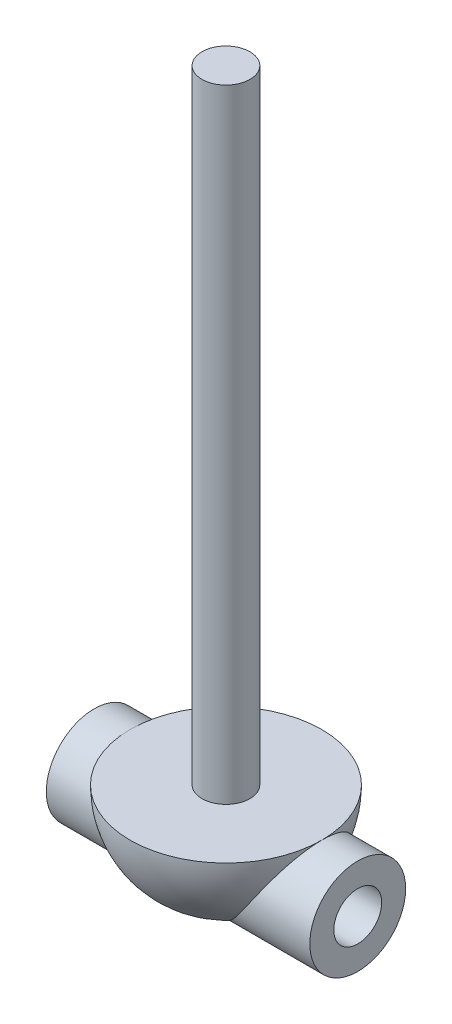
from build123d import *

# Parameters (mm, degrees)
OBR_T1_ANGLE                     = 180
DODANIE_WYCI_GNI_CIE1_DEPTH      = 27.5
DODANIE_WYCI_GNI_CIE1_DEPTH_BACK = 27.5
SZKIC4_R                         = 10
SZKIC5_R                         = 5
WYTNIJ_WYCI_GNI_CIE1_DEPTH       = 62.846584506
SZKIC6_R                         = 5
DODANIE_WYCI_GNI_CIE2_DEPTH      = 130


with BuildPart() as part:
    # Szkic3 → Obrót1 (revolve)
    with BuildSketch(Plane(origin=(0, 0, 0), x_dir=(1, 0, 0), z_dir=(0, 1, 0))):
        with BuildLine():
            Line((0, 20), (0, -20))
            ThreePointArc((0, -20), (20, 0), (0, 20))
        make_face()
    revolve(axis=Axis((0, 0, -20), (0, 0, -1)), revolution_arc=OBR_T1_ANGLE)

    # Szkic4 → Dodanie-wyciągnięcie1 (add, two sides: drawn at the far end of the back side and taken through both)
    with BuildSketch(Plane(origin=(0, 0, 0), x_dir=(0, 0, -1), z_dir=(1, 0, 0)).offset(-DODANIE_WYCI_GNI_CIE1_DEPTH_BACK)):
        with Locations((0, -10)):
            Circle(SZKIC4_R)
    extrude(amount=DODANIE_WYCI_GNI_CIE1_DEPTH + DODANIE_WYCI_GNI_CIE1_DEPTH_BACK)

    # Szkic5 → Wytnij-wyciągnięcie1 (cut, through all)
    with BuildSketch(Plane(origin=(27.5, 0, 0), x_dir=(0, 0, -1), z_dir=(1, 0, 0))):
        with Locations((0, -10)):
            Circle(SZKIC5_R)
    extrude(amount=-WYTNIJ_WYCI_GNI_CIE1_DEPTH, mode=Mode.SUBTRACT)

    # Szkic6 → Dodanie-wyciągnięcie2 (add)
    with BuildSketch(Plane(origin=(0, 0, 0), x_dir=(1, 0, 0), z_dir=(0, 1, 0))):
        Circle(SZKIC6_R)
    extrude(amount=DODANIE_WYCI_GNI_CIE2_DEPTH)


solid = part.part
